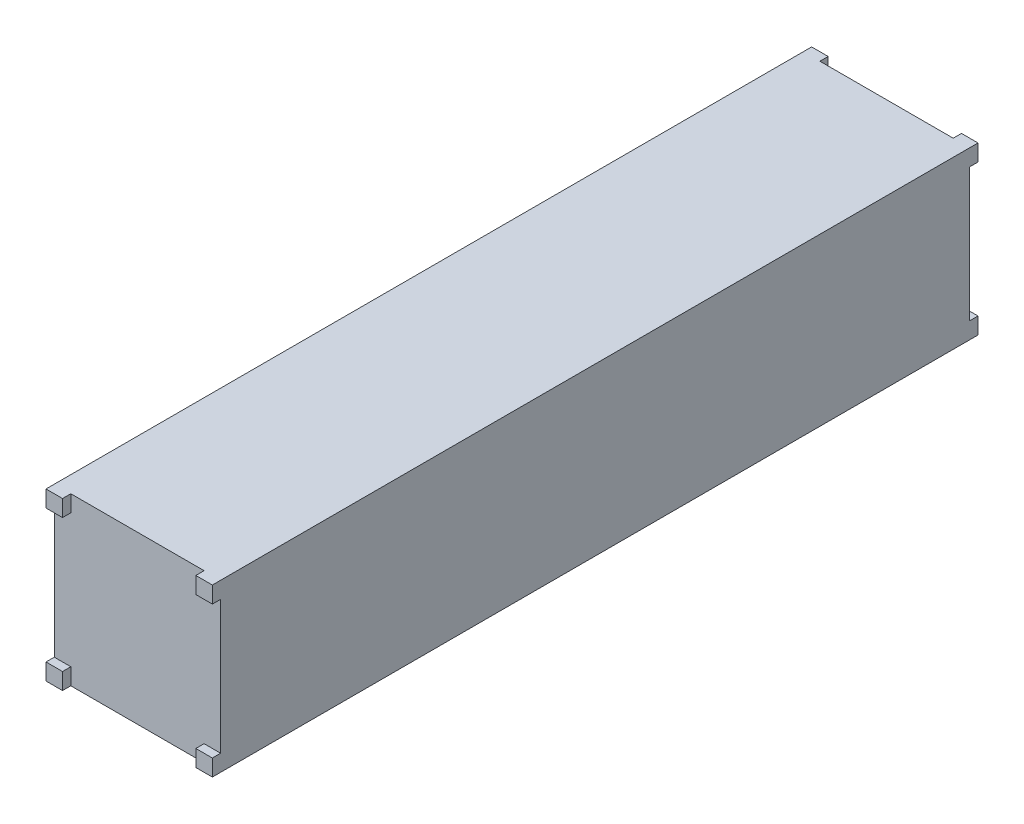
from build123d import *

# Parameters (mm, degrees)
SKETCH1_W           = 100.6
SKETCH1_H           = 100.6
BOSS_EXTRUDE1_DEPTH = 226.5
SKETCH2_W           = 10
SKETCH2_H           = 10
BOSS_EXTRUDE2_DEPTH = 5
SKETCH3_W           = 10
SKETCH3_H           = 10
BOSS_EXTRUDE3_DEPTH = 5


with BuildPart() as part:
    # Sketch1 → Boss-Extrude1 (new, symmetric)
    with BuildSketch(Plane.XY):
        Rectangle(SKETCH1_W, SKETCH1_H)
    extrude(amount=BOSS_EXTRUDE1_DEPTH, both=True)

    # Sketch2 → Boss-Extrude2 (add)
    with BuildSketch(Plane.XY.offset(226.5)):
        with Locations((-45.3, 45.3)):
            Rectangle(SKETCH2_W, SKETCH2_H)
        with Locations((45.3, 45.3)):
            Rectangle(SKETCH2_W, SKETCH2_H)
        with Locations((45.3, -45.3)):
            Rectangle(SKETCH2_W, SKETCH2_H)
        with Locations((-45.3, -45.3)):
            Rectangle(SKETCH2_W, SKETCH2_H)
    extrude(amount=BOSS_EXTRUDE2_DEPTH)

    # Sketch3 → Boss-Extrude3 (add)
    with BuildSketch(Plane(origin=(0, 0, -226.5), x_dir=(-1, 0, 0), z_dir=(0, 0, -1))):
        with Locations((-45.3, 45.3)):
            Rectangle(SKETCH3_W, SKETCH3_H)
        with Locations((45.3, 45.3)):
            Rectangle(SKETCH3_W, SKETCH3_H)
        with Locations((45.3, -45.3)):
            Rectangle(SKETCH3_W, SKETCH3_H)
        with Locations((-45.3, -45.3)):
            Rectangle(SKETCH3_W, SKETCH3_H)
    extrude(amount=BOSS_EXTRUDE3_DEPTH)


solid = part.part
